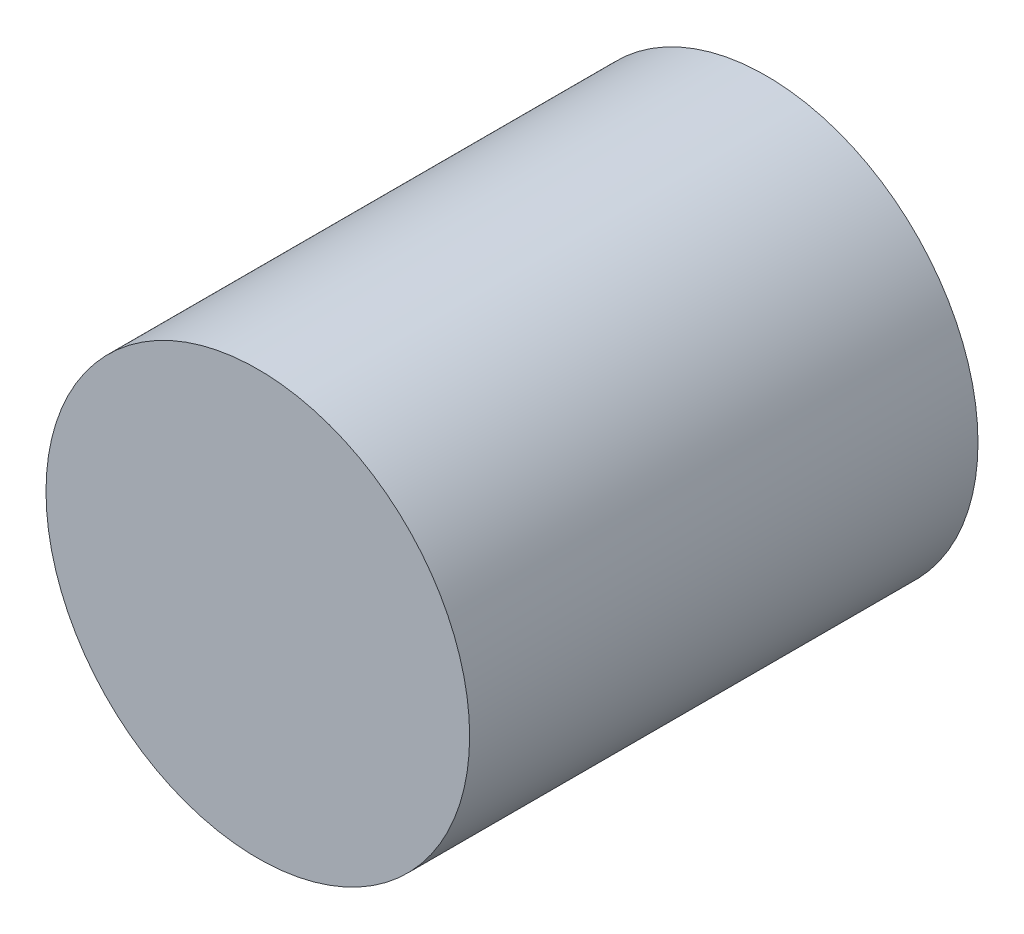
from build123d import *

# Parameters (mm, degrees)
SKETCH_1_W          = 40
SKETCH_1_H          = 30
EXTRUDE_1_DEPTH     = 12
SKETCH_2_OUTSIDE_W  = 52.284
SKETCH_2_OUTSIDE_H  = 42.284
SKETCH_2_OUTSIDE_R  = 5
CUT_EXTRUDE_1_DEPTH = 28.730849248


with BuildPart() as part:
    # 草图1 → 凸台-拉伸1 (new body)
    with BuildSketch(Plane.XY):
        Rectangle(SKETCH_1_W, SKETCH_1_H)
    extrude(amount=EXTRUDE_1_DEPTH)

    # 草图2 outside → 切除-拉伸1 (cut, through all)
    with BuildSketch(Plane.XY.offset(12)):
        Rectangle(SKETCH_2_OUTSIDE_W, SKETCH_2_OUTSIDE_H)
        Circle(SKETCH_2_OUTSIDE_R, mode=Mode.SUBTRACT)
    extrude(amount=-CUT_EXTRUDE_1_DEPTH, mode=Mode.SUBTRACT)


solid = part.part
